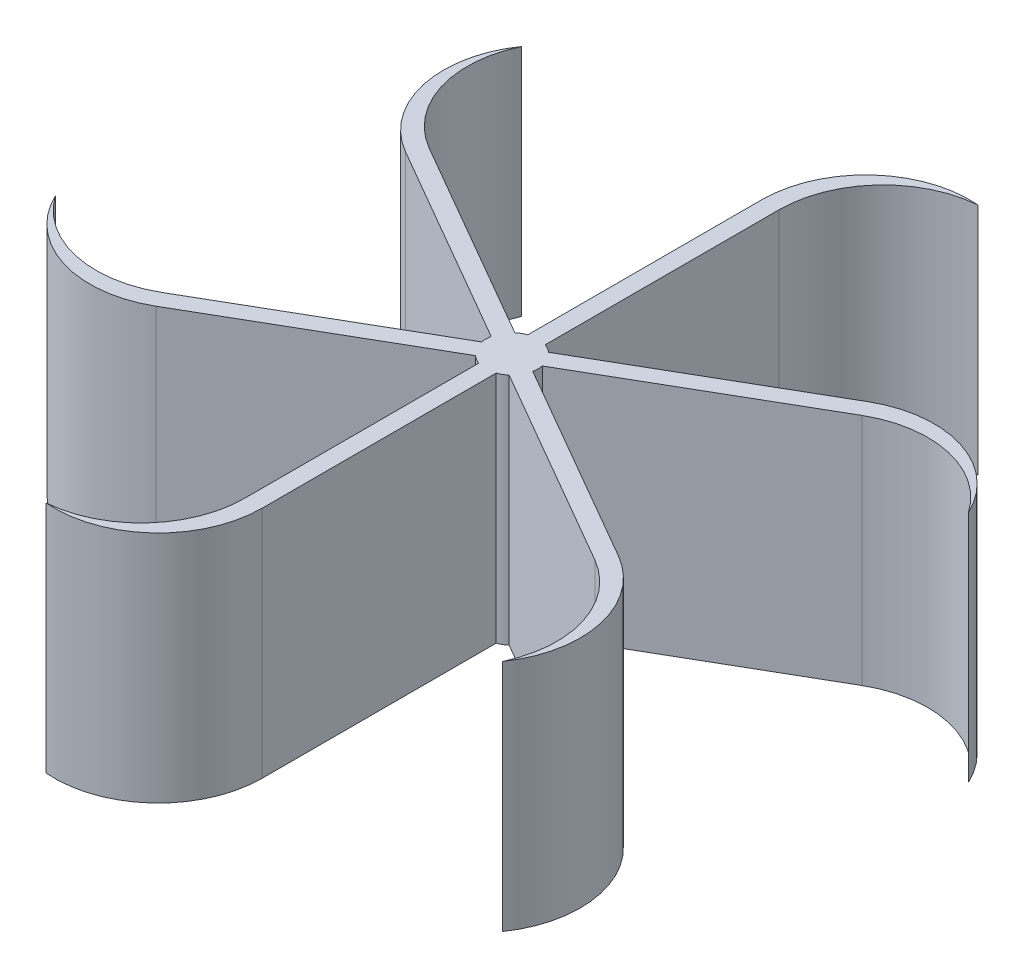
from build123d import *

# Parameters (mm, degrees)
BOSS_EXTRUDE1_DEPTH = 27


with BuildPart() as part:
    # Sketch2 → Boss-Extrude1 (new body)
    with BuildSketch(Plane(origin=(0, 0, 0), x_dir=(1, 0, 0), z_dir=(0, 1, 0))):
        with BuildLine():
            Line((1.949489743, 2.280238966), (25.332175645, 15.780238966))
            ThreePointArc((25.332175645, 15.780238966), (34.918685713, 16.839438194), (42.188333234, 10.501039089))
            ThreePointArc((42.188333234, 10.501039089), (34.951918852, 15.366431786), (26.332175645, 14.048188159))
            Line((26.332175645, 14.048188159), (2.949489743, 0.548188159))
            ThreePointArc((2.949489743, 0.548188159), (2.987345747, 0.275255129), (3, 0))
            ThreePointArc((3, 0), (2.987345747, -0.275255129), (2.949489743, -0.548188159))
            Line((2.949489743, -0.548188159), (26.332175645, -14.048188159))
            ThreePointArc((26.332175645, -14.048188159), (32.042724118, -21.820749797), (30.188333234, -31.285648779))
            ThreePointArc((30.188333234, -31.285648779), (30.783679718, -22.586033743), (25.332175645, -15.780238966))
            Line((25.332175645, -15.780238966), (1.949489743, -2.280238966))
            ThreePointArc((1.949489743, -2.280238966), (1.732050808, -2.449489743), (1.5, -2.598076211))
            ThreePointArc((1.5, -2.598076211), (1.25529494, -2.724744871), (1, -2.828427125))
            Line((1, -2.828427125), (1, -29.828427125))
            ThreePointArc((1, -29.828427125), (-2.875961595, -38.660187991), (-12, -41.786687868))
            ThreePointArc((-12, -41.786687868), (-4.168239134, -37.952465529), (-1, -29.828427125))
            Line((-1, -29.828427125), (-1, -2.828427125))
            ThreePointArc((-1, -2.828427125), (-1.25529494, -2.724744871), (-1.5, -2.598076211))
            ThreePointArc((-1.5, -2.598076211), (-1.732050808, -2.449489743), (-1.949489743, -2.280238966))
            Line((-1.949489743, -2.280238966), (-25.332175645, -15.780238966))
            ThreePointArc((-25.332175645, -15.780238966), (-34.918685713, -16.839438194), (-42.188333234, -10.501039089))
            ThreePointArc((-42.188333234, -10.501039089), (-34.951918852, -15.366431786), (-26.332175645, -14.048188159))
            Line((-26.332175645, -14.048188159), (-2.949489743, -0.548188159))
            ThreePointArc((-2.949489743, -0.548188159), (-2.987345747, -0.275255129), (-3, 0))
            ThreePointArc((-3, 0), (-2.987345747, 0.275255129), (-2.949489743, 0.548188159))
            Line((-2.949489743, 0.548188159), (-26.332175645, 14.048188159))
            ThreePointArc((-26.332175645, 14.048188159), (-32.042724118, 21.820749797), (-30.188333234, 31.285648779))
            ThreePointArc((-30.188333234, 31.285648779), (-30.783679718, 22.586033743), (-25.332175645, 15.780238966))
            Line((-25.332175645, 15.780238966), (-1.949489743, 2.280238966))
            ThreePointArc((-1.949489743, 2.280238966), (-1.732050808, 2.449489743), (-1.5, 2.598076211))
            ThreePointArc((-1.5, 2.598076211), (-1.25529494, 2.724744871), (-1, 2.828427125))
            Line((-1, 2.828427125), (-1, 29.828427125))
            ThreePointArc((-1, 29.828427125), (2.875961595, 38.660187991), (12, 41.786687868))
            ThreePointArc((12, 41.786687868), (4.168239134, 37.952465529), (1, 29.828427125))
            Line((1, 29.828427125), (1, 2.828427125))
            ThreePointArc((1, 2.828427125), (1.25529494, 2.724744871), (1.5, 2.598076211))
            ThreePointArc((1.5, 2.598076211), (1.732050808, 2.449489743), (1.949489743, 2.280238966))
        make_face()
    extrude(amount=BOSS_EXTRUDE1_DEPTH)


solid = part.part
